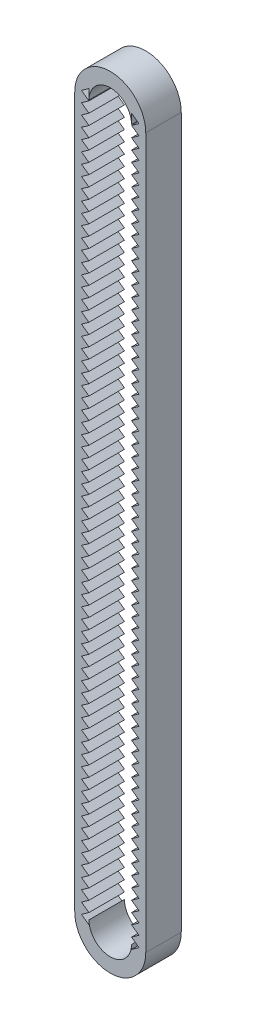
from build123d import *

# Parameters (mm, degrees)
SURFACE_EXTRUSION1_1_DEPTH     = 10
EPAISSIR1_T2                   = 4
ENL_V_MAT_EXTRU_1_DEPTH        = 10
R_P_TITION_LIN_AIRE1_COUNT     = 38
R_P_TITION_LIN_AIRE1_PITCH     = 3
R_P_TITION_LIN_AIRE1_COL_COUNT = 31
R_P_TITION_LIN_AIRE1_COL_PITCH = 3
SYM_TRIE1_COPY_1_DEPTH         = 10
SYM_TRIE1_COPY_2_DEPTH         = 10
SYM_TRIE1_COPY_3_DEPTH         = 10
SYM_TRIE1_COPY_4_DEPTH         = 10
SYM_TRIE1_COPY_5_DEPTH         = 10
SYM_TRIE1_COPY_6_DEPTH         = 10
SYM_TRIE1_COPY_7_DEPTH         = 10
SYM_TRIE1_COPY_8_DEPTH         = 10
SYM_TRIE1_COPY_9_DEPTH         = 10
SYM_TRIE1_COPY_10_DEPTH        = 10
SYM_TRIE1_COPY_11_DEPTH        = 10
SYM_TRIE1_COPY_12_DEPTH        = 10
SYM_TRIE1_COPY_13_DEPTH        = 10
SYM_TRIE1_COPY_14_DEPTH        = 10
SYM_TRIE1_COPY_15_DEPTH        = 10
SYM_TRIE1_COPY_16_DEPTH        = 10
SYM_TRIE1_COPY_17_DEPTH        = 10
SYM_TRIE1_COPY_18_DEPTH        = 10
SYM_TRIE1_COPY_19_DEPTH        = 10
SYM_TRIE1_COPY_20_DEPTH        = 10
SYM_TRIE1_COPY_21_DEPTH        = 10
SYM_TRIE1_COPY_22_DEPTH        = 10
SYM_TRIE1_COPY_23_DEPTH        = 10
SYM_TRIE1_COPY_24_DEPTH        = 10
SYM_TRIE1_COPY_25_DEPTH        = 10
SYM_TRIE1_COPY_26_DEPTH        = 10
SYM_TRIE1_COPY_27_DEPTH        = 10
SYM_TRIE1_COPY_28_DEPTH        = 10
SYM_TRIE1_COPY_29_DEPTH        = 10
SYM_TRIE1_COPY_30_DEPTH        = 10
SYM_TRIE1_COPY_31_DEPTH        = 10
SYM_TRIE1_COPY_32_DEPTH        = 10
SYM_TRIE1_COPY_33_DEPTH        = 10
SYM_TRIE1_COPY_34_DEPTH        = 10
SYM_TRIE1_COPY_35_DEPTH        = 10
SYM_TRIE1_COPY_36_DEPTH        = 10
SYM_TRIE1_COPY_37_DEPTH        = 10
SYM_TRIE1_COPY_38_DEPTH        = 10
SYM_TRIE1_COPY_39_DEPTH        = 10
SYM_TRIE1_COPY_40_DEPTH        = 10
SYM_TRIE1_COPY_41_DEPTH        = 10
SYM_TRIE1_COPY_42_DEPTH        = 10
SYM_TRIE1_COPY_43_DEPTH        = 10
SYM_TRIE1_COPY_44_DEPTH        = 10
SYM_TRIE1_COPY_45_DEPTH        = 10
SYM_TRIE1_COPY_46_DEPTH        = 10
SYM_TRIE1_COPY_47_DEPTH        = 10
SYM_TRIE1_COPY_48_DEPTH        = 10
SYM_TRIE1_COPY_49_DEPTH        = 10
SYM_TRIE1_COPY_50_DEPTH        = 10
SYM_TRIE1_COPY_51_DEPTH        = 10
SYM_TRIE1_COPY_52_DEPTH        = 10
SYM_TRIE1_COPY_53_DEPTH        = 10
SYM_TRIE1_COPY_54_DEPTH        = 10
SYM_TRIE1_COPY_55_DEPTH        = 10
SYM_TRIE1_COPY_56_DEPTH        = 10
SYM_TRIE1_COPY_57_DEPTH        = 10
SYM_TRIE1_COPY_58_DEPTH        = 10
SYM_TRIE1_COPY_59_DEPTH        = 10
SYM_TRIE1_COPY_60_DEPTH        = 10
SYM_TRIE1_COPY_61_DEPTH        = 10
SYM_TRIE1_COPY_62_DEPTH        = 10
SYM_TRIE1_COPY_63_DEPTH        = 10
SYM_TRIE1_COPY_64_DEPTH        = 10
SYM_TRIE1_COPY_65_DEPTH        = 10
SYM_TRIE1_COPY_66_DEPTH        = 10
SYM_TRIE1_COPY_67_DEPTH        = 10


with BuildPart() as body_1:
    # Surface-Extrusion1: a surface, the sketch's curves swept straight by 10 mm
    with BuildLine(Plane.XY, mode=Mode.PRIVATE) as surface_extrusion1_1_path:
        Line((-10, 0), (-10, 200))
        ThreePointArc((-10, 200), (0, 210), (10, 200))
        Line((10, 200), (10, 0))
        ThreePointArc((10, 0), (0, -10), (-10, 0))
    surface_extrusion1_1 = Shell.extrude(surface_extrusion1_1_path.wire(), (0 * SURFACE_EXTRUSION1_1_DEPTH, 0 * SURFACE_EXTRUSION1_1_DEPTH, 1 * SURFACE_EXTRUSION1_1_DEPTH))
    add(Solid.thicken(surface_extrusion1_1, -EPAISSIR1_T2))

    # Esquisse2 → Enlèv. mat.-Extru.1 (cut)
    with BuildSketch(Plane.XY.offset(10)):
        Polygon((-6, 109.791978845), (-8.105804757, 111.291978845), (-6, 112.791978845), align=None)
    enl_v_mat_extru_1 = extrude(amount=-ENL_V_MAT_EXTRU_1_DEPTH, mode=Mode.SUBTRACT)

    # Répétition linéaire1: Enlèv. mat.-Extru.1 ×38
    with Locations(*[(0, -i * R_P_TITION_LIN_AIRE1_PITCH, 0) for i in range(1, R_P_TITION_LIN_AIRE1_COUNT)]):
        add(enl_v_mat_extru_1, mode=Mode.SUBTRACT)

    # Répétition linéaire1 col: Enlèv. mat.-Extru.1 ×31
    with Locations(*[(0, i * R_P_TITION_LIN_AIRE1_COL_PITCH, 0) for i in range(1, R_P_TITION_LIN_AIRE1_COL_COUNT)]):
        add(enl_v_mat_extru_1, mode=Mode.SUBTRACT)

    # Symétrie1: Enlèv. mat.-Extru.1 across plane
    add(enl_v_mat_extru_1.mirror(Plane(origin=(0, 0, 0), x_dir=(0, 0, 1), z_dir=(1, 0, 0))), mode=Mode.SUBTRACT)

    # Symétrie1 copy 1 sketch → Symétrie1 copy 1 (cut)
    with BuildSketch(Plane(origin=(0, -3, 10), x_dir=(-1, 0, 0), z_dir=(0, 0, 1))):
        Polygon((-6, -109.791978845), (-8.105804757, -111.291978845), (-6, -112.791978845), align=None)
    extrude(amount=-SYM_TRIE1_COPY_1_DEPTH, mode=Mode.SUBTRACT)

    # Symétrie1 copy 2 sketch → Symétrie1 copy 2 (cut)
    with BuildSketch(Plane(origin=(0, -6, 10), x_dir=(-1, 0, 0), z_dir=(0, 0, 1))):
        Polygon((-6, -109.791978845), (-8.105804757, -111.291978845), (-6, -112.791978845), align=None)
    extrude(amount=-SYM_TRIE1_COPY_2_DEPTH, mode=Mode.SUBTRACT)

    # Symétrie1 copy 3 sketch → Symétrie1 copy 3 (cut)
    with BuildSketch(Plane(origin=(0, -9, 10), x_dir=(-1, 0, 0), z_dir=(0, 0, 1))):
        Polygon((-6, -109.791978845), (-8.105804757, -111.291978845), (-6, -112.791978845), align=None)
    extrude(amount=-SYM_TRIE1_COPY_3_DEPTH, mode=Mode.SUBTRACT)

    # Symétrie1 copy 4 sketch → Symétrie1 copy 4 (cut)
    with BuildSketch(Plane(origin=(0, -12, 10), x_dir=(-1, 0, 0), z_dir=(0, 0, 1))):
        Polygon((-6, -109.791978845), (-8.105804757, -111.291978845), (-6, -112.791978845), align=None)
    extrude(amount=-SYM_TRIE1_COPY_4_DEPTH, mode=Mode.SUBTRACT)

    # Symétrie1 copy 5 sketch → Symétrie1 copy 5 (cut)
    with BuildSketch(Plane(origin=(0, -15, 10), x_dir=(-1, 0, 0), z_dir=(0, 0, 1))):
        Polygon((-6, -109.791978845), (-8.105804757, -111.291978845), (-6, -112.791978845), align=None)
    extrude(amount=-SYM_TRIE1_COPY_5_DEPTH, mode=Mode.SUBTRACT)

    # Symétrie1 copy 6 sketch → Symétrie1 copy 6 (cut)
    with BuildSketch(Plane(origin=(0, -18, 10), x_dir=(-1, 0, 0), z_dir=(0, 0, 1))):
        Polygon((-6, -109.791978845), (-8.105804757, -111.291978845), (-6, -112.791978845), align=None)
    extrude(amount=-SYM_TRIE1_COPY_6_DEPTH, mode=Mode.SUBTRACT)

    # Symétrie1 copy 7 sketch → Symétrie1 copy 7 (cut)
    with BuildSketch(Plane(origin=(0, -21, 10), x_dir=(-1, 0, 0), z_dir=(0, 0, 1))):
        Polygon((-6, -109.791978845), (-8.105804757, -111.291978845), (-6, -112.791978845), align=None)
    extrude(amount=-SYM_TRIE1_COPY_7_DEPTH, mode=Mode.SUBTRACT)

    # Symétrie1 copy 8 sketch → Symétrie1 copy 8 (cut)
    with BuildSketch(Plane(origin=(0, -24, 10), x_dir=(-1, 0, 0), z_dir=(0, 0, 1))):
        Polygon((-6, -109.791978845), (-8.105804757, -111.291978845), (-6, -112.791978845), align=None)
    extrude(amount=-SYM_TRIE1_COPY_8_DEPTH, mode=Mode.SUBTRACT)

    # Symétrie1 copy 9 sketch → Symétrie1 copy 9 (cut)
    with BuildSketch(Plane(origin=(0, -27, 10), x_dir=(-1, 0, 0), z_dir=(0, 0, 1))):
        Polygon((-6, -109.791978845), (-8.105804757, -111.291978845), (-6, -112.791978845), align=None)
    extrude(amount=-SYM_TRIE1_COPY_9_DEPTH, mode=Mode.SUBTRACT)

    # Symétrie1 copy 10 sketch → Symétrie1 copy 10 (cut)
    with BuildSketch(Plane(origin=(0, -30, 10), x_dir=(-1, 0, 0), z_dir=(0, 0, 1))):
        Polygon((-6, -109.791978845), (-8.105804757, -111.291978845), (-6, -112.791978845), align=None)
    extrude(amount=-SYM_TRIE1_COPY_10_DEPTH, mode=Mode.SUBTRACT)

    # Symétrie1 copy 11 sketch → Symétrie1 copy 11 (cut)
    with BuildSketch(Plane(origin=(0, -33, 10), x_dir=(-1, 0, 0), z_dir=(0, 0, 1))):
        Polygon((-6, -109.791978845), (-8.105804757, -111.291978845), (-6, -112.791978845), align=None)
    extrude(amount=-SYM_TRIE1_COPY_11_DEPTH, mode=Mode.SUBTRACT)

    # Symétrie1 copy 12 sketch → Symétrie1 copy 12 (cut)
    with BuildSketch(Plane(origin=(0, -36, 10), x_dir=(-1, 0, 0), z_dir=(0, 0, 1))):
        Polygon((-6, -109.791978845), (-8.105804757, -111.291978845), (-6, -112.791978845), align=None)
    extrude(amount=-SYM_TRIE1_COPY_12_DEPTH, mode=Mode.SUBTRACT)

    # Symétrie1 copy 13 sketch → Symétrie1 copy 13 (cut)
    with BuildSketch(Plane(origin=(0, -39, 10), x_dir=(-1, 0, 0), z_dir=(0, 0, 1))):
        Polygon((-6, -109.791978845), (-8.105804757, -111.291978845), (-6, -112.791978845), align=None)
    extrude(amount=-SYM_TRIE1_COPY_13_DEPTH, mode=Mode.SUBTRACT)

    # Symétrie1 copy 14 sketch → Symétrie1 copy 14 (cut)
    with BuildSketch(Plane(origin=(0, -42, 10), x_dir=(-1, 0, 0), z_dir=(0, 0, 1))):
        Polygon((-6, -109.791978845), (-8.105804757, -111.291978845), (-6, -112.791978845), align=None)
    extrude(amount=-SYM_TRIE1_COPY_14_DEPTH, mode=Mode.SUBTRACT)

    # Symétrie1 copy 15 sketch → Symétrie1 copy 15 (cut)
    with BuildSketch(Plane(origin=(0, -45, 10), x_dir=(-1, 0, 0), z_dir=(0, 0, 1))):
        Polygon((-6, -109.791978845), (-8.105804757, -111.291978845), (-6, -112.791978845), align=None)
    extrude(amount=-SYM_TRIE1_COPY_15_DEPTH, mode=Mode.SUBTRACT)

    # Symétrie1 copy 16 sketch → Symétrie1 copy 16 (cut)
    with BuildSketch(Plane(origin=(0, -48, 10), x_dir=(-1, 0, 0), z_dir=(0, 0, 1))):
        Polygon((-6, -109.791978845), (-8.105804757, -111.291978845), (-6, -112.791978845), align=None)
    extrude(amount=-SYM_TRIE1_COPY_16_DEPTH, mode=Mode.SUBTRACT)

    # Symétrie1 copy 17 sketch → Symétrie1 copy 17 (cut)
    with BuildSketch(Plane(origin=(0, -51, 10), x_dir=(-1, 0, 0), z_dir=(0, 0, 1))):
        Polygon((-6, -109.791978845), (-8.105804757, -111.291978845), (-6, -112.791978845), align=None)
    extrude(amount=-SYM_TRIE1_COPY_17_DEPTH, mode=Mode.SUBTRACT)

    # Symétrie1 copy 18 sketch → Symétrie1 copy 18 (cut)
    with BuildSketch(Plane(origin=(0, -54, 10), x_dir=(-1, 0, 0), z_dir=(0, 0, 1))):
        Polygon((-6, -109.791978845), (-8.105804757, -111.291978845), (-6, -112.791978845), align=None)
    extrude(amount=-SYM_TRIE1_COPY_18_DEPTH, mode=Mode.SUBTRACT)

    # Symétrie1 copy 19 sketch → Symétrie1 copy 19 (cut)
    with BuildSketch(Plane(origin=(0, -57, 10), x_dir=(-1, 0, 0), z_dir=(0, 0, 1))):
        Polygon((-6, -109.791978845), (-8.105804757, -111.291978845), (-6, -112.791978845), align=None)
    extrude(amount=-SYM_TRIE1_COPY_19_DEPTH, mode=Mode.SUBTRACT)

    # Symétrie1 copy 20 sketch → Symétrie1 copy 20 (cut)
    with BuildSketch(Plane(origin=(0, -60, 10), x_dir=(-1, 0, 0), z_dir=(0, 0, 1))):
        Polygon((-6, -109.791978845), (-8.105804757, -111.291978845), (-6, -112.791978845), align=None)
    extrude(amount=-SYM_TRIE1_COPY_20_DEPTH, mode=Mode.SUBTRACT)

    # Symétrie1 copy 21 sketch → Symétrie1 copy 21 (cut)
    with BuildSketch(Plane(origin=(0, -63, 10), x_dir=(-1, 0, 0), z_dir=(0, 0, 1))):
        Polygon((-6, -109.791978845), (-8.105804757, -111.291978845), (-6, -112.791978845), align=None)
    extrude(amount=-SYM_TRIE1_COPY_21_DEPTH, mode=Mode.SUBTRACT)

    # Symétrie1 copy 22 sketch → Symétrie1 copy 22 (cut)
    with BuildSketch(Plane(origin=(0, -66, 10), x_dir=(-1, 0, 0), z_dir=(0, 0, 1))):
        Polygon((-6, -109.791978845), (-8.105804757, -111.291978845), (-6, -112.791978845), align=None)
    extrude(amount=-SYM_TRIE1_COPY_22_DEPTH, mode=Mode.SUBTRACT)

    # Symétrie1 copy 23 sketch → Symétrie1 copy 23 (cut)
    with BuildSketch(Plane(origin=(0, -69, 10), x_dir=(-1, 0, 0), z_dir=(0, 0, 1))):
        Polygon((-6, -109.791978845), (-8.105804757, -111.291978845), (-6, -112.791978845), align=None)
    extrude(amount=-SYM_TRIE1_COPY_23_DEPTH, mode=Mode.SUBTRACT)

    # Symétrie1 copy 24 sketch → Symétrie1 copy 24 (cut)
    with BuildSketch(Plane(origin=(0, -72, 10), x_dir=(-1, 0, 0), z_dir=(0, 0, 1))):
        Polygon((-6, -109.791978845), (-8.105804757, -111.291978845), (-6, -112.791978845), align=None)
    extrude(amount=-SYM_TRIE1_COPY_24_DEPTH, mode=Mode.SUBTRACT)

    # Symétrie1 copy 25 sketch → Symétrie1 copy 25 (cut)
    with BuildSketch(Plane(origin=(0, -75, 10), x_dir=(-1, 0, 0), z_dir=(0, 0, 1))):
        Polygon((-6, -109.791978845), (-8.105804757, -111.291978845), (-6, -112.791978845), align=None)
    extrude(amount=-SYM_TRIE1_COPY_25_DEPTH, mode=Mode.SUBTRACT)

    # Symétrie1 copy 26 sketch → Symétrie1 copy 26 (cut)
    with BuildSketch(Plane(origin=(0, -78, 10), x_dir=(-1, 0, 0), z_dir=(0, 0, 1))):
        Polygon((-6, -109.791978845), (-8.105804757, -111.291978845), (-6, -112.791978845), align=None)
    extrude(amount=-SYM_TRIE1_COPY_26_DEPTH, mode=Mode.SUBTRACT)

    # Symétrie1 copy 27 sketch → Symétrie1 copy 27 (cut)
    with BuildSketch(Plane(origin=(0, -81, 10), x_dir=(-1, 0, 0), z_dir=(0, 0, 1))):
        Polygon((-6, -109.791978845), (-8.105804757, -111.291978845), (-6, -112.791978845), align=None)
    extrude(amount=-SYM_TRIE1_COPY_27_DEPTH, mode=Mode.SUBTRACT)

    # Symétrie1 copy 28 sketch → Symétrie1 copy 28 (cut)
    with BuildSketch(Plane(origin=(0, -84, 10), x_dir=(-1, 0, 0), z_dir=(0, 0, 1))):
        Polygon((-6, -109.791978845), (-8.105804757, -111.291978845), (-6, -112.791978845), align=None)
    extrude(amount=-SYM_TRIE1_COPY_28_DEPTH, mode=Mode.SUBTRACT)

    # Symétrie1 copy 29 sketch → Symétrie1 copy 29 (cut)
    with BuildSketch(Plane(origin=(0, -87, 10), x_dir=(-1, 0, 0), z_dir=(0, 0, 1))):
        Polygon((-6, -109.791978845), (-8.105804757, -111.291978845), (-6, -112.791978845), align=None)
    extrude(amount=-SYM_TRIE1_COPY_29_DEPTH, mode=Mode.SUBTRACT)

    # Symétrie1 copy 30 sketch → Symétrie1 copy 30 (cut)
    with BuildSketch(Plane(origin=(0, -90, 10), x_dir=(-1, 0, 0), z_dir=(0, 0, 1))):
        Polygon((-6, -109.791978845), (-8.105804757, -111.291978845), (-6, -112.791978845), align=None)
    extrude(amount=-SYM_TRIE1_COPY_30_DEPTH, mode=Mode.SUBTRACT)

    # Symétrie1 copy 31 sketch → Symétrie1 copy 31 (cut)
    with BuildSketch(Plane(origin=(0, -93, 10), x_dir=(-1, 0, 0), z_dir=(0, 0, 1))):
        Polygon((-6, -109.791978845), (-8.105804757, -111.291978845), (-6, -112.791978845), align=None)
    extrude(amount=-SYM_TRIE1_COPY_31_DEPTH, mode=Mode.SUBTRACT)

    # Symétrie1 copy 32 sketch → Symétrie1 copy 32 (cut)
    with BuildSketch(Plane(origin=(0, -96, 10), x_dir=(-1, 0, 0), z_dir=(0, 0, 1))):
        Polygon((-6, -109.791978845), (-8.105804757, -111.291978845), (-6, -112.791978845), align=None)
    extrude(amount=-SYM_TRIE1_COPY_32_DEPTH, mode=Mode.SUBTRACT)

    # Symétrie1 copy 33 sketch → Symétrie1 copy 33 (cut)
    with BuildSketch(Plane(origin=(0, -99, 10), x_dir=(-1, 0, 0), z_dir=(0, 0, 1))):
        Polygon((-6, -109.791978845), (-8.105804757, -111.291978845), (-6, -112.791978845), align=None)
    extrude(amount=-SYM_TRIE1_COPY_33_DEPTH, mode=Mode.SUBTRACT)

    # Symétrie1 copy 34 sketch → Symétrie1 copy 34 (cut)
    with BuildSketch(Plane(origin=(0, -102, 10), x_dir=(-1, 0, 0), z_dir=(0, 0, 1))):
        Polygon((-6, -109.791978845), (-8.105804757, -111.291978845), (-6, -112.791978845), align=None)
    extrude(amount=-SYM_TRIE1_COPY_34_DEPTH, mode=Mode.SUBTRACT)

    # Symétrie1 copy 35 sketch → Symétrie1 copy 35 (cut)
    with BuildSketch(Plane(origin=(0, -105, 10), x_dir=(-1, 0, 0), z_dir=(0, 0, 1))):
        Polygon((-6, -109.791978845), (-8.105804757, -111.291978845), (-6, -112.791978845), align=None)
    extrude(amount=-SYM_TRIE1_COPY_35_DEPTH, mode=Mode.SUBTRACT)

    # Symétrie1 copy 36 sketch → Symétrie1 copy 36 (cut)
    with BuildSketch(Plane(origin=(0, -108, 10), x_dir=(-1, 0, 0), z_dir=(0, 0, 1))):
        Polygon((-6, -109.791978845), (-8.105804757, -111.291978845), (-6, -112.791978845), align=None)
    extrude(amount=-SYM_TRIE1_COPY_36_DEPTH, mode=Mode.SUBTRACT)

    # Symétrie1 copy 37 sketch → Symétrie1 copy 37 (cut)
    with BuildSketch(Plane(origin=(0, -111, 10), x_dir=(-1, 0, 0), z_dir=(0, 0, 1))):
        Polygon((-6, -109.791978845), (-8.105804757, -111.291978845), (-6, -112.791978845), align=None)
    extrude(amount=-SYM_TRIE1_COPY_37_DEPTH, mode=Mode.SUBTRACT)

    # Symétrie1 copy 38 sketch → Symétrie1 copy 38 (cut)
    with BuildSketch(Plane(origin=(0, 3, 10), x_dir=(-1, 0, 0), z_dir=(0, 0, 1))):
        Polygon((-6, -109.791978845), (-8.105804757, -111.291978845), (-6, -112.791978845), align=None)
    extrude(amount=-SYM_TRIE1_COPY_38_DEPTH, mode=Mode.SUBTRACT)

    # Symétrie1 copy 39 sketch → Symétrie1 copy 39 (cut)
    with BuildSketch(Plane(origin=(0, 6, 10), x_dir=(-1, 0, 0), z_dir=(0, 0, 1))):
        Polygon((-6, -109.791978845), (-8.105804757, -111.291978845), (-6, -112.791978845), align=None)
    extrude(amount=-SYM_TRIE1_COPY_39_DEPTH, mode=Mode.SUBTRACT)

    # Symétrie1 copy 40 sketch → Symétrie1 copy 40 (cut)
    with BuildSketch(Plane(origin=(0, 9, 10), x_dir=(-1, 0, 0), z_dir=(0, 0, 1))):
        Polygon((-6, -109.791978845), (-8.105804757, -111.291978845), (-6, -112.791978845), align=None)
    extrude(amount=-SYM_TRIE1_COPY_40_DEPTH, mode=Mode.SUBTRACT)

    # Symétrie1 copy 41 sketch → Symétrie1 copy 41 (cut)
    with BuildSketch(Plane(origin=(0, 12, 10), x_dir=(-1, 0, 0), z_dir=(0, 0, 1))):
        Polygon((-6, -109.791978845), (-8.105804757, -111.291978845), (-6, -112.791978845), align=None)
    extrude(amount=-SYM_TRIE1_COPY_41_DEPTH, mode=Mode.SUBTRACT)

    # Symétrie1 copy 42 sketch → Symétrie1 copy 42 (cut)
    with BuildSketch(Plane(origin=(0, 15, 10), x_dir=(-1, 0, 0), z_dir=(0, 0, 1))):
        Polygon((-6, -109.791978845), (-8.105804757, -111.291978845), (-6, -112.791978845), align=None)
    extrude(amount=-SYM_TRIE1_COPY_42_DEPTH, mode=Mode.SUBTRACT)

    # Symétrie1 copy 43 sketch → Symétrie1 copy 43 (cut)
    with BuildSketch(Plane(origin=(0, 18, 10), x_dir=(-1, 0, 0), z_dir=(0, 0, 1))):
        Polygon((-6, -109.791978845), (-8.105804757, -111.291978845), (-6, -112.791978845), align=None)
    extrude(amount=-SYM_TRIE1_COPY_43_DEPTH, mode=Mode.SUBTRACT)

    # Symétrie1 copy 44 sketch → Symétrie1 copy 44 (cut)
    with BuildSketch(Plane(origin=(0, 21, 10), x_dir=(-1, 0, 0), z_dir=(0, 0, 1))):
        Polygon((-6, -109.791978845), (-8.105804757, -111.291978845), (-6, -112.791978845), align=None)
    extrude(amount=-SYM_TRIE1_COPY_44_DEPTH, mode=Mode.SUBTRACT)

    # Symétrie1 copy 45 sketch → Symétrie1 copy 45 (cut)
    with BuildSketch(Plane(origin=(0, 24, 10), x_dir=(-1, 0, 0), z_dir=(0, 0, 1))):
        Polygon((-6, -109.791978845), (-8.105804757, -111.291978845), (-6, -112.791978845), align=None)
    extrude(amount=-SYM_TRIE1_COPY_45_DEPTH, mode=Mode.SUBTRACT)

    # Symétrie1 copy 46 sketch → Symétrie1 copy 46 (cut)
    with BuildSketch(Plane(origin=(0, 27, 10), x_dir=(-1, 0, 0), z_dir=(0, 0, 1))):
        Polygon((-6, -109.791978845), (-8.105804757, -111.291978845), (-6, -112.791978845), align=None)
    extrude(amount=-SYM_TRIE1_COPY_46_DEPTH, mode=Mode.SUBTRACT)

    # Symétrie1 copy 47 sketch → Symétrie1 copy 47 (cut)
    with BuildSketch(Plane(origin=(0, 30, 10), x_dir=(-1, 0, 0), z_dir=(0, 0, 1))):
        Polygon((-6, -109.791978845), (-8.105804757, -111.291978845), (-6, -112.791978845), align=None)
    extrude(amount=-SYM_TRIE1_COPY_47_DEPTH, mode=Mode.SUBTRACT)

    # Symétrie1 copy 48 sketch → Symétrie1 copy 48 (cut)
    with BuildSketch(Plane(origin=(0, 33, 10), x_dir=(-1, 0, 0), z_dir=(0, 0, 1))):
        Polygon((-6, -109.791978845), (-8.105804757, -111.291978845), (-6, -112.791978845), align=None)
    extrude(amount=-SYM_TRIE1_COPY_48_DEPTH, mode=Mode.SUBTRACT)

    # Symétrie1 copy 49 sketch → Symétrie1 copy 49 (cut)
    with BuildSketch(Plane(origin=(0, 36, 10), x_dir=(-1, 0, 0), z_dir=(0, 0, 1))):
        Polygon((-6, -109.791978845), (-8.105804757, -111.291978845), (-6, -112.791978845), align=None)
    extrude(amount=-SYM_TRIE1_COPY_49_DEPTH, mode=Mode.SUBTRACT)

    # Symétrie1 copy 50 sketch → Symétrie1 copy 50 (cut)
    with BuildSketch(Plane(origin=(0, 39, 10), x_dir=(-1, 0, 0), z_dir=(0, 0, 1))):
        Polygon((-6, -109.791978845), (-8.105804757, -111.291978845), (-6, -112.791978845), align=None)
    extrude(amount=-SYM_TRIE1_COPY_50_DEPTH, mode=Mode.SUBTRACT)

    # Symétrie1 copy 51 sketch → Symétrie1 copy 51 (cut)
    with BuildSketch(Plane(origin=(0, 42, 10), x_dir=(-1, 0, 0), z_dir=(0, 0, 1))):
        Polygon((-6, -109.791978845), (-8.105804757, -111.291978845), (-6, -112.791978845), align=None)
    extrude(amount=-SYM_TRIE1_COPY_51_DEPTH, mode=Mode.SUBTRACT)

    # Symétrie1 copy 52 sketch → Symétrie1 copy 52 (cut)
    with BuildSketch(Plane(origin=(0, 45, 10), x_dir=(-1, 0, 0), z_dir=(0, 0, 1))):
        Polygon((-6, -109.791978845), (-8.105804757, -111.291978845), (-6, -112.791978845), align=None)
    extrude(amount=-SYM_TRIE1_COPY_52_DEPTH, mode=Mode.SUBTRACT)

    # Symétrie1 copy 53 sketch → Symétrie1 copy 53 (cut)
    with BuildSketch(Plane(origin=(0, 48, 10), x_dir=(-1, 0, 0), z_dir=(0, 0, 1))):
        Polygon((-6, -109.791978845), (-8.105804757, -111.291978845), (-6, -112.791978845), align=None)
    extrude(amount=-SYM_TRIE1_COPY_53_DEPTH, mode=Mode.SUBTRACT)

    # Symétrie1 copy 54 sketch → Symétrie1 copy 54 (cut)
    with BuildSketch(Plane(origin=(0, 51, 10), x_dir=(-1, 0, 0), z_dir=(0, 0, 1))):
        Polygon((-6, -109.791978845), (-8.105804757, -111.291978845), (-6, -112.791978845), align=None)
    extrude(amount=-SYM_TRIE1_COPY_54_DEPTH, mode=Mode.SUBTRACT)

    # Symétrie1 copy 55 sketch → Symétrie1 copy 55 (cut)
    with BuildSketch(Plane(origin=(0, 54, 10), x_dir=(-1, 0, 0), z_dir=(0, 0, 1))):
        Polygon((-6, -109.791978845), (-8.105804757, -111.291978845), (-6, -112.791978845), align=None)
    extrude(amount=-SYM_TRIE1_COPY_55_DEPTH, mode=Mode.SUBTRACT)

    # Symétrie1 copy 56 sketch → Symétrie1 copy 56 (cut)
    with BuildSketch(Plane(origin=(0, 57, 10), x_dir=(-1, 0, 0), z_dir=(0, 0, 1))):
        Polygon((-6, -109.791978845), (-8.105804757, -111.291978845), (-6, -112.791978845), align=None)
    extrude(amount=-SYM_TRIE1_COPY_56_DEPTH, mode=Mode.SUBTRACT)

    # Symétrie1 copy 57 sketch → Symétrie1 copy 57 (cut)
    with BuildSketch(Plane(origin=(0, 60, 10), x_dir=(-1, 0, 0), z_dir=(0, 0, 1))):
        Polygon((-6, -109.791978845), (-8.105804757, -111.291978845), (-6, -112.791978845), align=None)
    extrude(amount=-SYM_TRIE1_COPY_57_DEPTH, mode=Mode.SUBTRACT)

    # Symétrie1 copy 58 sketch → Symétrie1 copy 58 (cut)
    with BuildSketch(Plane(origin=(0, 63, 10), x_dir=(-1, 0, 0), z_dir=(0, 0, 1))):
        Polygon((-6, -109.791978845), (-8.105804757, -111.291978845), (-6, -112.791978845), align=None)
    extrude(amount=-SYM_TRIE1_COPY_58_DEPTH, mode=Mode.SUBTRACT)

    # Symétrie1 copy 59 sketch → Symétrie1 copy 59 (cut)
    with BuildSketch(Plane(origin=(0, 66, 10), x_dir=(-1, 0, 0), z_dir=(0, 0, 1))):
        Polygon((-6, -109.791978845), (-8.105804757, -111.291978845), (-6, -112.791978845), align=None)
    extrude(amount=-SYM_TRIE1_COPY_59_DEPTH, mode=Mode.SUBTRACT)

    # Symétrie1 copy 60 sketch → Symétrie1 copy 60 (cut)
    with BuildSketch(Plane(origin=(0, 69, 10), x_dir=(-1, 0, 0), z_dir=(0, 0, 1))):
        Polygon((-6, -109.791978845), (-8.105804757, -111.291978845), (-6, -112.791978845), align=None)
    extrude(amount=-SYM_TRIE1_COPY_60_DEPTH, mode=Mode.SUBTRACT)

    # Symétrie1 copy 61 sketch → Symétrie1 copy 61 (cut)
    with BuildSketch(Plane(origin=(0, 72, 10), x_dir=(-1, 0, 0), z_dir=(0, 0, 1))):
        Polygon((-6, -109.791978845), (-8.105804757, -111.291978845), (-6, -112.791978845), align=None)
    extrude(amount=-SYM_TRIE1_COPY_61_DEPTH, mode=Mode.SUBTRACT)

    # Symétrie1 copy 62 sketch → Symétrie1 copy 62 (cut)
    with BuildSketch(Plane(origin=(0, 75, 10), x_dir=(-1, 0, 0), z_dir=(0, 0, 1))):
        Polygon((-6, -109.791978845), (-8.105804757, -111.291978845), (-6, -112.791978845), align=None)
    extrude(amount=-SYM_TRIE1_COPY_62_DEPTH, mode=Mode.SUBTRACT)

    # Symétrie1 copy 63 sketch → Symétrie1 copy 63 (cut)
    with BuildSketch(Plane(origin=(0, 78, 10), x_dir=(-1, 0, 0), z_dir=(0, 0, 1))):
        Polygon((-6, -109.791978845), (-8.105804757, -111.291978845), (-6, -112.791978845), align=None)
    extrude(amount=-SYM_TRIE1_COPY_63_DEPTH, mode=Mode.SUBTRACT)

    # Symétrie1 copy 64 sketch → Symétrie1 copy 64 (cut)
    with BuildSketch(Plane(origin=(0, 81, 10), x_dir=(-1, 0, 0), z_dir=(0, 0, 1))):
        Polygon((-6, -109.791978845), (-8.105804757, -111.291978845), (-6, -112.791978845), align=None)
    extrude(amount=-SYM_TRIE1_COPY_64_DEPTH, mode=Mode.SUBTRACT)

    # Symétrie1 copy 65 sketch → Symétrie1 copy 65 (cut)
    with BuildSketch(Plane(origin=(0, 84, 10), x_dir=(-1, 0, 0), z_dir=(0, 0, 1))):
        Polygon((-6, -109.791978845), (-8.105804757, -111.291978845), (-6, -112.791978845), align=None)
    extrude(amount=-SYM_TRIE1_COPY_65_DEPTH, mode=Mode.SUBTRACT)

    # Symétrie1 copy 66 sketch → Symétrie1 copy 66 (cut)
    with BuildSketch(Plane(origin=(0, 87, 10), x_dir=(-1, 0, 0), z_dir=(0, 0, 1))):
        Polygon((-6, -109.791978845), (-8.105804757, -111.291978845), (-6, -112.791978845), align=None)
    extrude(amount=-SYM_TRIE1_COPY_66_DEPTH, mode=Mode.SUBTRACT)

    # Symétrie1 copy 67 sketch → Symétrie1 copy 67 (cut)
    with BuildSketch(Plane(origin=(0, 90, 10), x_dir=(-1, 0, 0), z_dir=(0, 0, 1))):
        Polygon((-6, -109.791978845), (-8.105804757, -111.291978845), (-6, -112.791978845), align=None)
    extrude(amount=-SYM_TRIE1_COPY_67_DEPTH, mode=Mode.SUBTRACT)


solid = body_1.part
